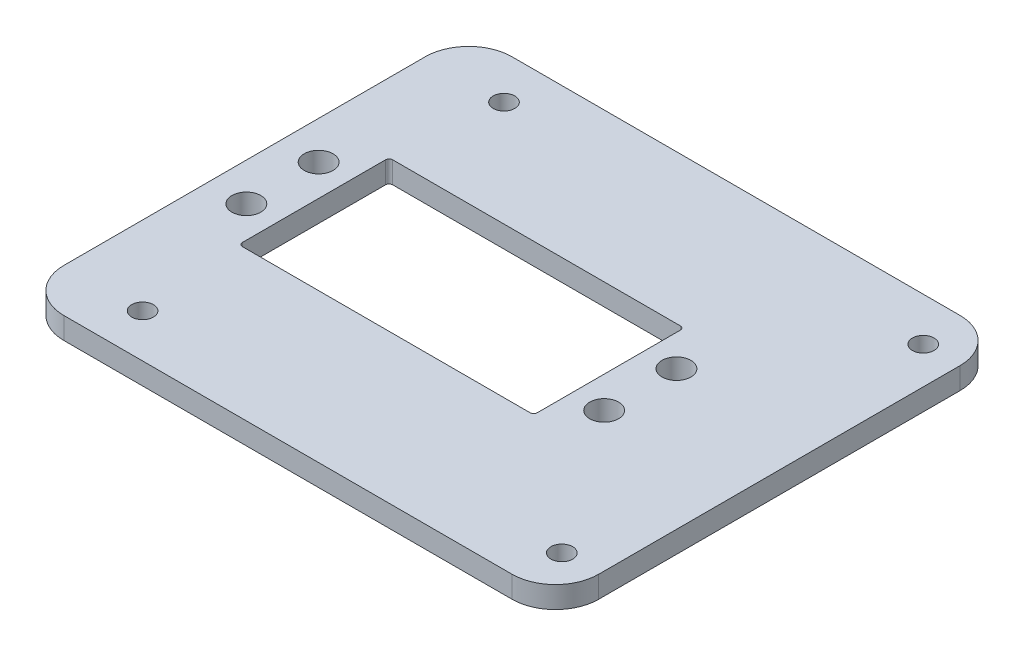
from build123d import *

# Parameters (mm, degrees)
SKETCH_1_W      = 60
SKETCH_1_H      = 62
SKETCH_1_R      = 2
SKETCH_1_R_2    = 1.5
SKETCH_1_W_2    = 40.8
SKETCH_1_H_2    = 20.8
SKETCH_1_W_3    = 14
EXTRUDE_1_DEPTH = 3
FILLET_1_R      = 0.5
FILLET_2_R      = 6


with BuildPart() as part:
    # 草图1 → 凸台-拉伸1 (new body)
    # profile 1 of 2: a face of its own
    with BuildSketch(Plane(origin=(0, 0, 0), x_dir=(1, 0, 0), z_dir=(0, 1, 0))):
        Rectangle(SKETCH_1_W, SKETCH_1_H)
        with Locations(Location((-24.75, 5, 0), (0, 0, 270))):
            Circle(SKETCH_1_R, mode=Mode.SUBTRACT)
        with Locations(Location((-24.75, -5, 0), (0, 0, 270))):
            Circle(SKETCH_1_R, mode=Mode.SUBTRACT)
        with Locations(Location((24.75, 5, 0), (0, 0, 270))):
            Circle(SKETCH_1_R, mode=Mode.SUBTRACT)
        with Locations(Location((24.75, -5, 0), (0, 0, 270))):
            Circle(SKETCH_1_R, mode=Mode.SUBTRACT)
        with Locations(Location((-19.11, 25, 0), (0, 0, 270))):
            Circle(SKETCH_1_R_2, mode=Mode.SUBTRACT)
        with Locations(Location((-19.11, -25, 0), (0, 0, 270))):
            Circle(SKETCH_1_R_2, mode=Mode.SUBTRACT)
        Rectangle(SKETCH_1_W_2, SKETCH_1_H_2, mode=Mode.SUBTRACT)
    # profile 2 of 2: a face of its own
    with BuildSketch(Plane(origin=(0, 0, 0), x_dir=(1, 0, 0), z_dir=(0, 1, 0))):
        with Locations((37, 0)):
            Rectangle(SKETCH_1_W_3, SKETCH_1_H)
        with Locations(Location((38.89, -25, 0), (0, 0, 270))):
            Circle(SKETCH_1_R_2, mode=Mode.SUBTRACT)
        with Locations(Location((38.89, 25, 0), (0, 0, 270))):
            Circle(SKETCH_1_R_2, mode=Mode.SUBTRACT)
    extrude(amount=EXTRUDE_1_DEPTH)

    # 圆角1
    fillet_1_edges = [part.edges().sort_by_distance(p)[0] for p in [
        (20.4, 1.5, -10.4),
        (-20.4, 1.5, -10.4),
        (-20.4, 1.5, 10.4),
        (20.4, 1.5, 10.4),
    ]]
    fillet(fillet_1_edges, radius=FILLET_1_R)

    # 圆角2
    fillet_2_edges = [part.edges().sort_by_distance(p)[0] for p in [
        (-30, 1.5, 31),
        (-30, 1.5, -31),
        (44, 1.5, -31),
        (44, 1.5, 31),
    ]]
    fillet(fillet_2_edges, radius=FILLET_2_R)


solid = part.part
